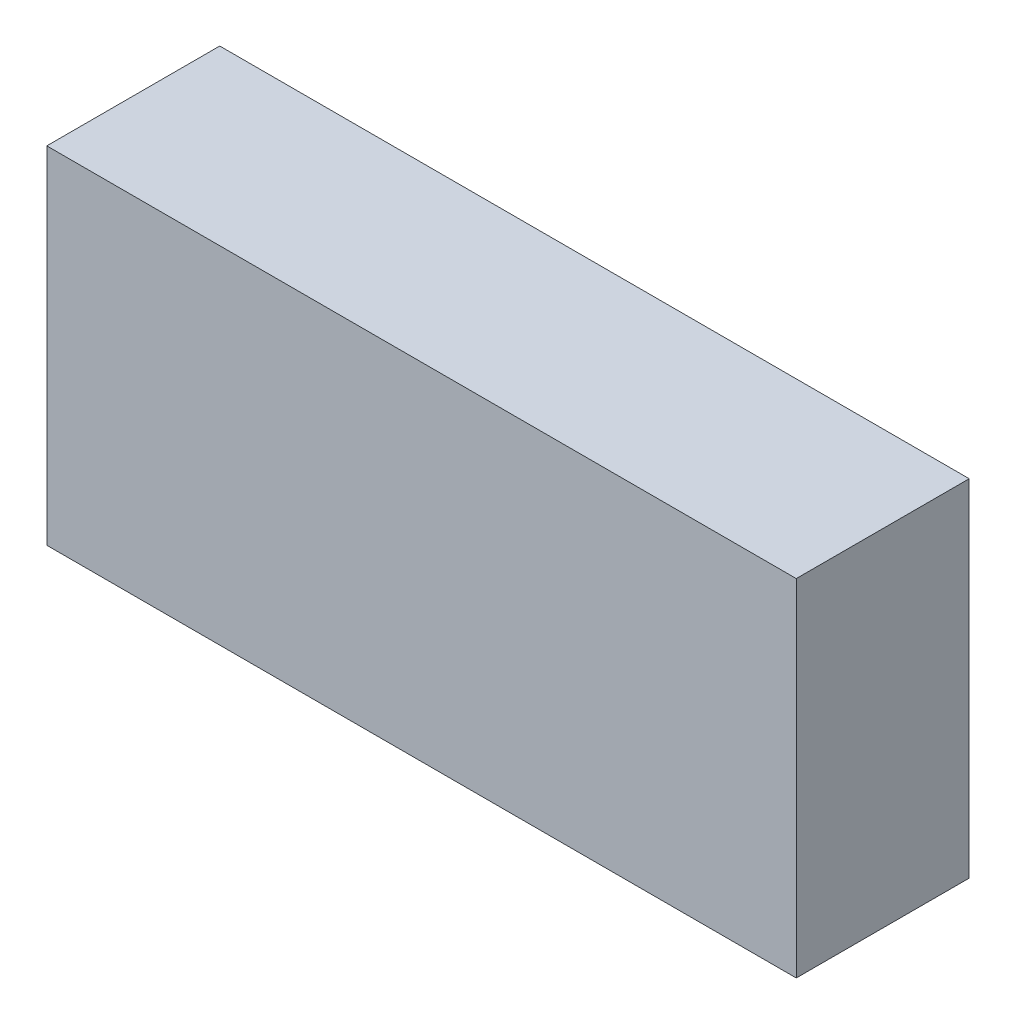
from build123d import *

# Parameters (mm, degrees)
SKETCH1_W           = 82.55
SKETCH1_H           = 19.05
BOSS_EXTRUDE1_DEPTH = 38.1


with BuildPart() as part:
    # Sketch1 → Boss-Extrude1 (new body)
    with BuildSketch(Plane(origin=(0, 0, 0), x_dir=(1, 0, 0), z_dir=(0, 1, 0))):
        Rectangle(SKETCH1_W, SKETCH1_H)
    extrude(amount=BOSS_EXTRUDE1_DEPTH)


solid = part.part
